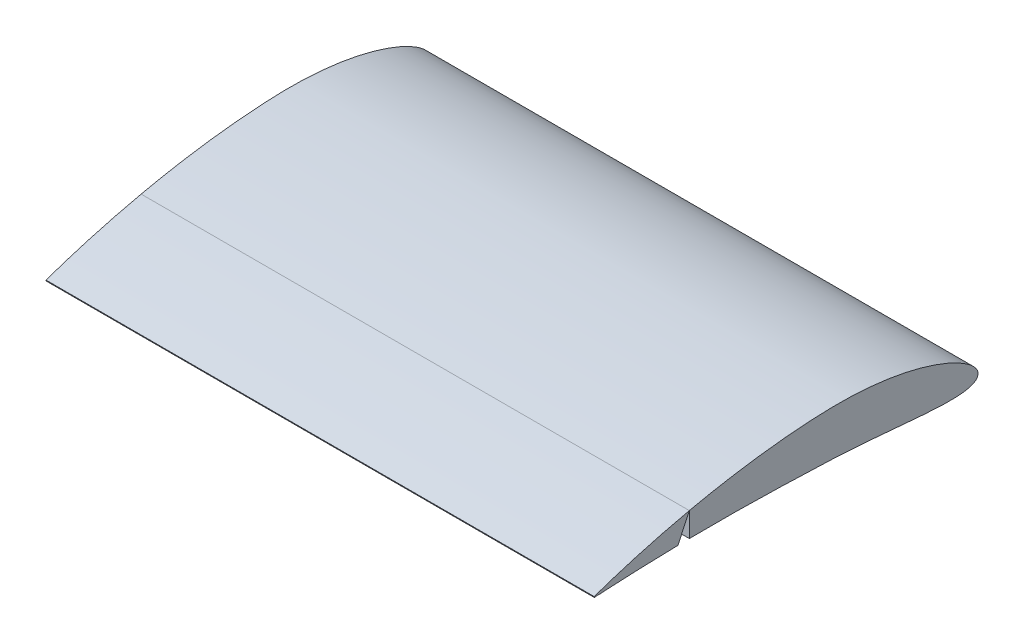
from build123d import *

# Parameters (mm, degrees)
BOSS_EXTRUDE1_DEPTH      = 254
BOSS_EXTRUDE1_DEPTH_BACK = 254
CUT_EXTRUDE1_REACH       = 623.109


with BuildPart() as part:
    # Sketch1 → Boss-Extrude1 (new, two sides: drawn at the far end of the back side and taken through both)
    with BuildSketch(Plane(origin=(0, 0, 0), x_dir=(0, 0, -1), z_dir=(1, 0, 0)).offset(-BOSS_EXTRUDE1_DEPTH_BACK)):
        with BuildLine():
            Line((-354.787327228, -0.030257196), (-354.876173011, 0.410417887))
            add(Edge.make_bspline(
                [(-354.876173011, 0.410417887), (-354.559877309, 0.519388), (-353.29965963, 0.95355787), (-350.47872665, 1.927095868), (-345.800950265, 3.497798274), (-336.024074692, 6.721551148), (-319.654473712, 11.798891927), (-300.598349456, 17.130600639), (-282.422876264, 21.724272526), (-261.175777938, 26.651569731), (-238.622276389, 31.145528798), (-208.774809213, 36.004755717), (-183.96165787, 39.090454058), (-158.902335219, 41.113212891), (-140.096691022, 42.111376668), (-121.516747473, 42.228858195), (-103.422167262, 41.321050632), (-86.188408528, 39.478676181), (-70.043450957, 36.810480574), (-55.199760436, 33.432905997), (-41.843390777, 29.510854383), (-30.130463623, 25.220125297), (-20.187014188, 20.73431935), (-12.107203154, 16.226289935), (-5.926897661, 11.855341958), (-1.679224073, 7.716499794), (0.765838065, 3.796757813), (0.987487677, -0.148325216), (-1.35108726, -3.308943186), (-5.450780885, -5.288085739), (-11.087315968, -6.587464624), (-18.34911979, -7.268527656), (-27.163826626, -7.404874951), (-37.447057223, -7.053797092), (-49.083078017, -6.301866785), (-61.95239395, -5.238034817), (-75.929862643, -3.983911698), (-96.406736552, -2.153555858), (-117.937239158, -0.458414508), (-140.484776897, 0.674535203), (-158.296467959, 1.286744043), (-176.48388462, 1.917893193), (-200.671973719, 2.586246563), (-224.541124114, 2.979106232), (-247.830237405, 3.028480659), (-264.337268621, 2.907447598), (-279.933149694, 2.656365926), (-294.437996632, 2.282890374), (-307.681856469, 1.852126627), (-319.513378006, 1.371074809), (-329.767358246, 0.912902227), (-338.388880463, 0.426846955), (-345.076973543, 0.191518705), (-350.227621538, -0.406394891), (-352.780150329, -0.035387827), (-354.744619464, -0.75811662), (-354.777220059, -0.20251155), (-354.787327228, -0.030257196)],
                knots=[0, 0, 0, 0, 0.001371577, 0.005464776, 0.012234802, 0.021601969, 0.04767125, 0.082496261, 0.102719149, 0.124527079, 0.171912573, 0.19697838, 0.248496767, 0.274385101, 0.300041178, 0.325689988, 0.350525088, 0.374279703, 0.396711254, 0.417576734, 0.436654006, 0.45374439, 0.468679994, 0.481329415, 0.491630702, 0.499615789, 0.505546281, 0.510184984, 0.514824194, 0.520701508, 0.52851604, 0.538465752, 0.550542609, 0.564643256, 0.580638139, 0.598344876, 0.617584458, 0.638174401, 0.682632113, 0.706120665, 0.730727383, 0.755700244, 0.780731769, 0.829932396, 0.853570292, 0.876213105, 0.897609987, 0.917519394, 0.935698347, 0.951942678, 0.966047159, 0.97783994, 0.987174002, 0.993931501, 0.998018399, 0.999385644, 1, 1, 1, 1], degree=3))
        make_face()
    extrude(amount=BOSS_EXTRUDE1_DEPTH + BOSS_EXTRUDE1_DEPTH_BACK)

    # Sketch2 → Cut-Extrude1 (cut, up to next)
    with BuildSketch(Plane.ZY.offset(254), mode=Mode.PRIVATE) as cut_extrude1_sk1:
        Polygon((266.7, 25.310988042), (266.7, 2.06571301), (277.539449763, 2.06571301), align=None)
    cut_extrude1_tool1 = extrude(cut_extrude1_sk1.sketch, amount=-CUT_EXTRUDE1_REACH, mode=Mode.PRIVATE) & part.part
    add(cut_extrude1_tool1.solids().sort_by_distance((-254, 9.814138, 270.31315))[0], mode=Mode.SUBTRACT)


with BuildPart() as cut_extrude1_piece_1:
    # of the separate pieces the step leaves, piece 1, a body of its own (cut_extrude1_pieces)
    add(part.part.solids().sort_by_distance((0, 2.854788865, 266.7))[0])


with BuildPart() as cut_extrude1_piece_2:
    # of the separate pieces the step leaves, piece 2, a body of its own (cut_extrude1_pieces)
    add(part.part.solids().sort_by_distance((0, -0.030257196, 354.787327228))[0])


solid = Compound([cut_extrude1_piece_1.part, cut_extrude1_piece_2.part])
